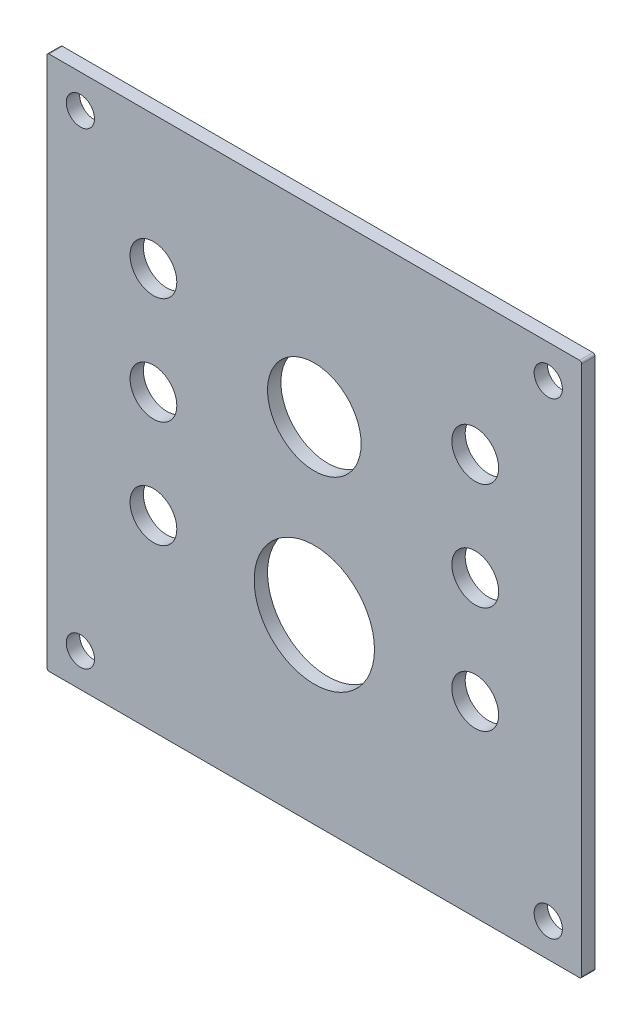
from build123d import *
from build123d.topology import SkipClean

# Parameters (mm, degrees)
EXTRUDE1_START = 10
SKETCH1_W      = 63.5
SKETCH1_H      = 127
EXTRUDE1_DEPTH = 1.5875
SKETCH2_R      = 3.3528
SKETCH2_R_2    = 11.1125
SKETCH2_R_3    = 14.2875
SKETCH2_R_4    = 5.55625
EXTRUDE2_DEPTH = 90.858670283
FILLET1_R      = 0.508


with BuildPart() as part:
    # Sketch1 → Extrude1 (new, symmetric)
    with BuildSketch(Plane.XY.offset(EXTRUDE1_START)):
        with Locations((-31.75, 0)):
            Rectangle(SKETCH1_W, SKETCH1_H)
    extrude(amount=EXTRUDE1_DEPTH, both=True)

    # Sketch2 → Extrude2 (cut, through all)
    with BuildSketch(Plane.XY.offset(11.5875)):
        with Locations(Location((-55.5625, -55.5625, 0), (0, 0, 180))):
            Circle(SKETCH2_R)
        with Locations((0, 20.3454)):
            Circle(SKETCH2_R_2)
        with Locations((0, -20.3454)):
            Circle(SKETCH2_R_3)
        with Locations((-38.214808, 6.35)):
            Circle(SKETCH2_R_4)
        with Locations((-38.214808, -19.05)):
            Circle(SKETCH2_R_4)
        with Locations((-38.214808, 31.75)):
            Circle(SKETCH2_R_4)
        with Locations((-55.5625, 55.5625)):
            Circle(SKETCH2_R)
    extrude(amount=-EXTRUDE2_DEPTH, mode=Mode.SUBTRACT)

    # Fillet1
    fillet1_edges = [part.edges().sort_by_distance(p)[0] for p in [
        (-63.5, 63.5, 10),
        (-63.5, -63.5, 10),
    ]]
    fillet(fillet1_edges, radius=FILLET1_R)

    # Mirror1: part across plane


with BuildPart() as part_1:
    with SkipClean():  # the faces are left unmerged after this step: merging them gives an invalid solid
        add(part.part)
        add(part.part.mirror(Plane(origin=(0, 63.5, 11.5875), x_dir=(0, 0, 1), z_dir=(-1, 0, 0))))


solid = part_1.part
